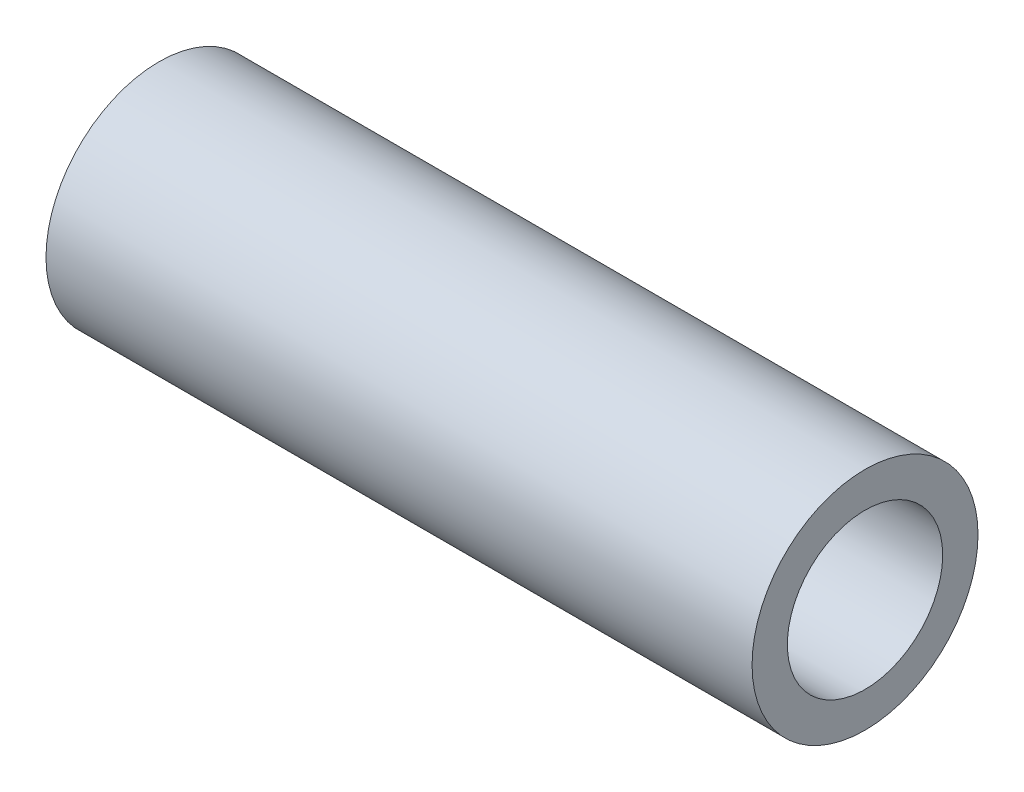
from build123d import *

# Parameters (mm, degrees)
SKETCH1_R           = 4
SKETCH1_R_2         = 2.75
BOSS_EXTRUDE1_DEPTH = 12.5


with BuildPart() as part:
    # Sketch1 → Boss-Extrude1 (new, symmetric)
    with BuildSketch(Plane(origin=(0, 0, 0), x_dir=(0, 0, -1), z_dir=(1, 0, 0))):
        Circle(SKETCH1_R)
        Circle(SKETCH1_R_2, mode=Mode.SUBTRACT)
    extrude(amount=BOSS_EXTRUDE1_DEPTH, both=True)


solid = part.part
